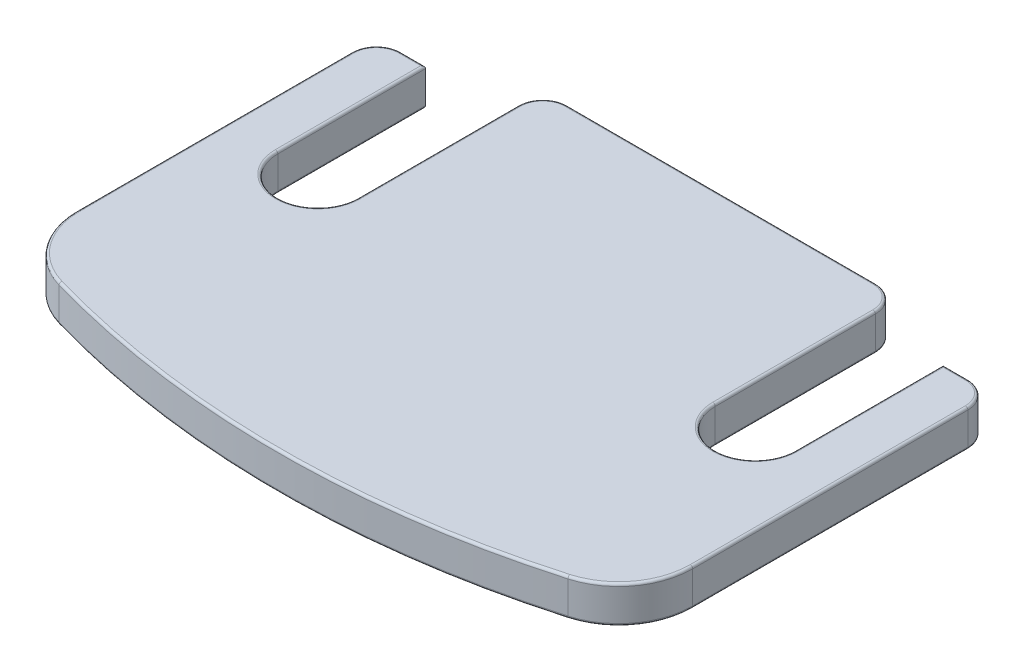
from build123d import *

# Parameters (mm, degrees)
BOSS_EXTRUDE1_DEPTH = 3
FILLET1_R           = 0.2


with BuildPart() as part:
    # Sketch1 → Boss-Extrude1 (new body)
    with BuildSketch(Plane(origin=(0, 0, 0), x_dir=(1, 0, 0), z_dir=(0, 1, 0))):
        with BuildLine():
            Line((-25, 8.667504193), (-25, 31))
            ThreePointArc((-25, 31), (-24.414213562, 32.414213562), (-23, 33))
            Line((-23, 33), (-21, 33))
            Line((-21, 33), (-21, 21))
            ThreePointArc((-21, 21), (-17.75, 17.75), (-14.5, 21))
            Line((-14.5, 21), (-14.5, 34))
            ThreePointArc((-14.5, 34), (-13.914213562, 35.414213562), (-12.5, 36))
            Line((-12.5, 36), (12.5, 36))
            ThreePointArc((12.5, 36), (13.914213562, 35.414213562), (14.5, 34))
            Line((14.5, 34), (14.5, 21))
            ThreePointArc((14.5, 21), (17.75, 17.75), (21, 21))
            Line((21, 21), (21, 33))
            Line((21, 33), (23, 33))
            ThreePointArc((23, 33), (24.414213562, 32.414213562), (25, 31))
            Line((25, 31), (25, 8.667504193))
            ThreePointArc((25, 8.667504193), (23.791296457, 5.0559286), (20.652173913, 2.899461079))
            ThreePointArc((20.652173913, 2.899461079), (0, 0), (-20.652173913, 2.899461079))
            ThreePointArc((-20.652173913, 2.899461079), (-23.791296457, 5.0559286), (-25, 8.667504193))
        make_face()
    extrude(amount=BOSS_EXTRUDE1_DEPTH)

    # Fillet1
    fillet1_edges = [part.edges().sort_by_distance(p)[0] for p in [
        (-22, 3, -33),
        (-24.414213562, 3, -32.414213562),
        (-14.5, 0, -27.5),
        (-25, 3, -19.833752096),
        (-13.914213562, 0, -35.414213562),
        (0, 0, -36),
        (13.914213562, 0, -35.414213562),
        (14.5, 0, -27.5),
        (17.75, 0, -17.75),
        (21, 0, -27),
        (22, 0, -33),
        (24.414213562, 0, -32.414213562),
        (-23.791296457, 3, -5.0559286),
        (25, 0, -19.833752096),
        (23.791296457, 0, -5.0559286),
        (0, 0, 0),
        (-23.791296457, 0, -5.0559286),
        (-25, 0, -19.833752096),
        (-24.414213562, 0, -32.414213562),
        (-22, 0, -33),
        (0, 3, 0),
        (-21, 0, -27),
        (-17.75, 0, -17.75),
        (23.791296457, 3, -5.0559286),
        (25, 3, -19.833752096),
        (24.414213562, 3, -32.414213562),
        (22, 3, -33),
        (21, 3, -27),
        (-17.75, 3, -17.75),
        (17.75, 3, -17.75),
        (14.5, 3, -27.5),
        (13.914213562, 3, -35.414213562),
        (0, 3, -36),
        (-13.914213562, 3, -35.414213562),
        (-14.5, 3, -27.5),
        (-21, 3, -27),
    ]]
    fillet(fillet1_edges, radius=FILLET1_R)


solid = part.part
